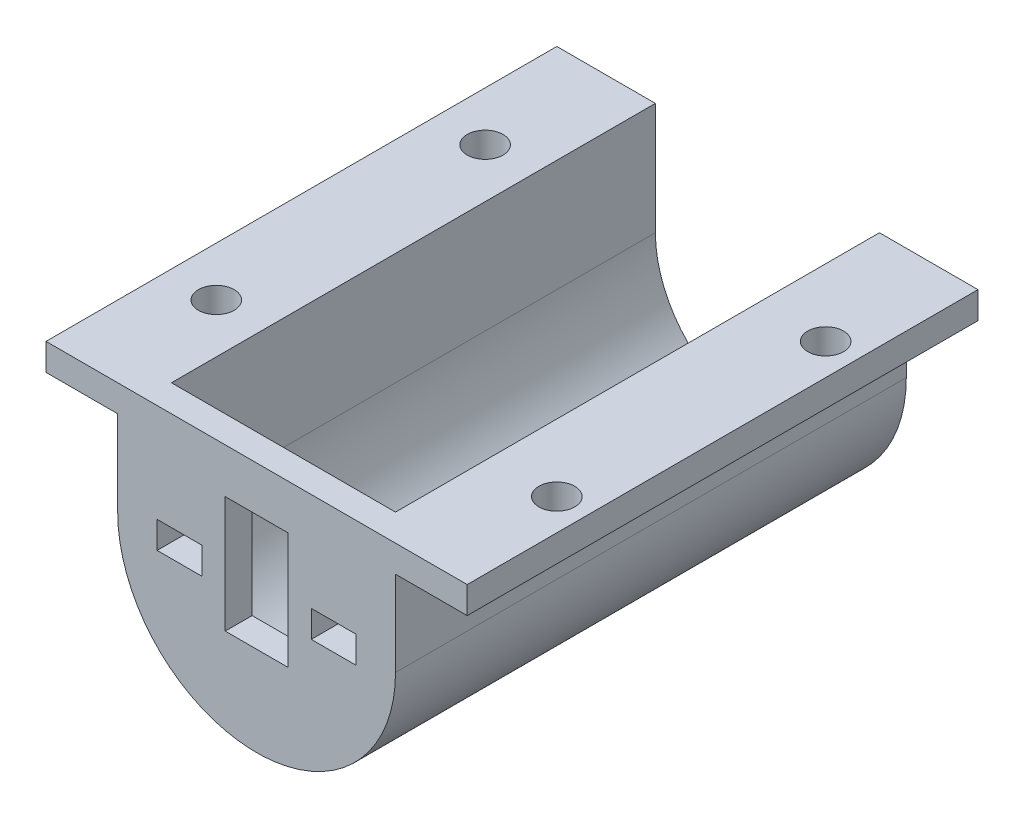
from build123d import *

# Parameters (mm, degrees)
SALIENTE_EXTRUIR1_DEPTH = 28.5
CROQUIS2_R              = 2
CORTAR_EXTRUIR1_DEPTH   = 5
SALIENTE_EXTRUIR2_DEPTH = 3
CROQUIS4_W              = 5
CROQUIS4_H              = 3
CROQUIS4_W_2            = 7
CROQUIS4_H_2            = 13
CORTAR_EXTRUIR3_DEPTH   = 3


with BuildPart() as part:
    # Croquis1 → Saliente-Extruir1 (new, symmetric)
    with BuildSketch(Plane.XY):
        with BuildLine():
            Line((-12.5, 0), (-12.5, 12.5))
            Line((-12.5, 12.5), (-23.5, 12.5))
            Line((-23.5, 12.5), (-23.5, 9.5))
            Line((-23.5, 9.5), (-15.5, 9.5))
            Line((-15.5, 9.5), (-15.5, 0))
            ThreePointArc((-15.5, 0), (0, -15.5), (15.5, 0))
            Line((15.5, 0), (15.5, 9.5))
            Line((15.5, 9.5), (23.5, 9.5))
            Line((23.5, 9.5), (23.5, 12.5))
            Line((23.5, 12.5), (12.5, 12.5))
            Line((12.5, 12.5), (12.5, 0))
            ThreePointArc((12.5, 0), (0, -12.5), (-12.5, 0))
        make_face()
    extrude(amount=SALIENTE_EXTRUIR1_DEPTH, both=True)

    # Croquis2 → Cortar-Extruir1 (cut)
    with BuildSketch(Plane.XZ.offset(-9.5)):
        with Locations((-18, 15)):
            Circle(CROQUIS2_R)
        with Locations((-18, -15)):
            Circle(CROQUIS2_R)
        with Locations((20, 15)):
            Circle(CROQUIS2_R)
        with Locations((20, -15)):
            Circle(CROQUIS2_R)
    extrude(amount=-CORTAR_EXTRUIR1_DEPTH, mode=Mode.SUBTRACT)

    # Croquis3 → Saliente-Extruir2 (add)
    with BuildSketch(Plane.XY.offset(28.5)):
        with BuildLine():
            Line((-15.5, 12.5), (15.5, 12.5))
            Line((15.5, 12.5), (15.5, 0))
            ThreePointArc((15.5, 0), (0, -15.5), (-15.5, 0))
            Line((-15.5, 0), (-15.5, 12.5))
        make_face()
    extrude(amount=-SALIENTE_EXTRUIR2_DEPTH)

    # Croquis4 → Cortar-Extruir3 (cut)
    with BuildSketch(Plane.XY.offset(28.5)):
        with Locations((-8.6, 0)):
            Rectangle(CROQUIS4_W, CROQUIS4_H)
        with Locations((0, 1)):
            Rectangle(CROQUIS4_W_2, CROQUIS4_H_2)
        with Locations((8.6, 0)):
            Rectangle(CROQUIS4_W, CROQUIS4_H)
    extrude(amount=-CORTAR_EXTRUIR3_DEPTH, mode=Mode.SUBTRACT)


solid = part.part
